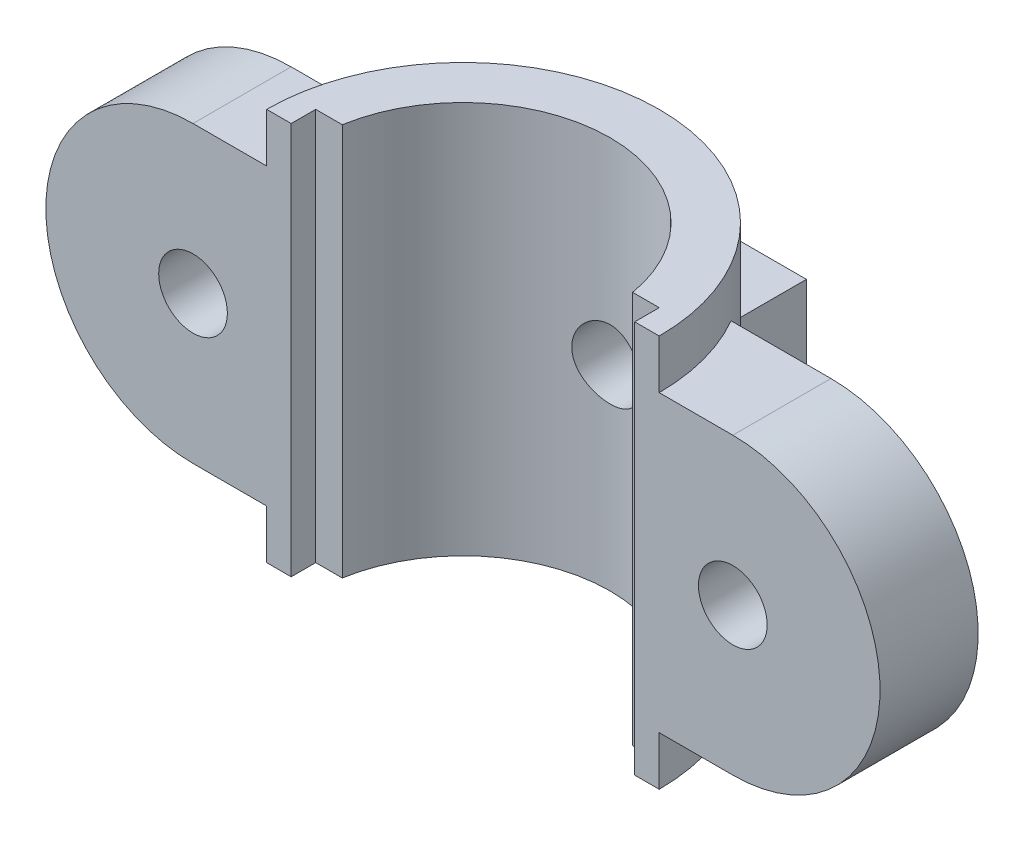
from build123d import *

# Parameters (mm, degrees)
BOSS_EXTRUDE1_DEPTH      = 20
BOSS_EXTRUDE2_DEPTH      = 40
CUT_EXTRUDE1_REACH       = 120.427
SKETCH6_R                = 30
BOSS_EXTRUDE3_REACH      = 108.419
BOSS_EXTRUDE3_END_RADIUS = 40
SKETCH7_W                = 40
SKETCH7_H                = 30
SKETCH7_W_2              = 30
SKETCH7_H_2              = 20
SKETCH8_W                = 70
SKETCH8_H                = 5
CUT_EXTRUDE2_DEPTH       = 121.519707932
HOLE1_D                  = 14
HOLE2_D                  = 14
HOLE2_DEPTH              = 20
HOLE2_CBORE_D            = 20
HOLE2_CBORE_DEPTH        = 5
HOLE2_TIP                = 4.206024333


with BuildPart() as part:
    # Sketch1 → Boss-Extrude1 (new body)
    with BuildSketch(Plane.XY):
        with BuildLine():
            Line((-55, 30), (55, 30))
            ThreePointArc((55, 30), (85, 0), (55, -30))
            Line((55, -30), (-55, -30))
            ThreePointArc((-55, -30), (-85, 0), (-55, 30))
        make_face()
    extrude(amount=BOSS_EXTRUDE1_DEPTH)

    # Sketch5 → Boss-Extrude2 (add, symmetric)
    with BuildSketch(Plane(origin=(0, 0, 0), x_dir=(1, 0, 0), z_dir=(0, 1, 0))):
        with BuildLine():
            Line((-40, -20), (40, -20))
            ThreePointArc((40, -20), (0, 20), (-40, -20))
        make_face()
    extrude(amount=BOSS_EXTRUDE2_DEPTH, both=True)

    # Sketch6 → Cut-Extrude1 (cut, up to next)
    with BuildSketch(Plane(origin=(0, -40, 0), x_dir=(-1, 0, 0), z_dir=(0, -1, 0)), mode=Mode.PRIVATE) as cut_extrude1_sk1:
        with Locations((0, -20)):
            Circle(SKETCH6_R)
    cut_extrude1_tool1 = extrude(cut_extrude1_sk1.sketch, amount=-CUT_EXTRUDE1_REACH, mode=Mode.PRIVATE) & part.part
    add(cut_extrude1_tool1.solids().sort_by_distance((0, -40, 20))[0], mode=Mode.SUBTRACT)

    # Boss-Extrude3: up to this cylinder (the profile starts outside it)
    boss_extrude3_end = Plane(origin=(0, 14.5, 20), z_dir=(0, -1, 0)) * Cylinder(BOSS_EXTRUDE3_END_RADIUS, 297.838, mode=Mode.PRIVATE)
    # Sketch7 → Boss-Extrude3 (add, up to the surface)
    with BuildSketch(Plane(origin=(0, 0, -30), x_dir=(-1, 0, 0), z_dir=(0, 0, -1)), mode=Mode.PRIVATE) as boss_extrude3_sk1:
        Rectangle(SKETCH7_W, SKETCH7_H)
        Rectangle(SKETCH7_W_2, SKETCH7_H_2, mode=Mode.SUBTRACT)
    boss_extrude3_tool1 = extrude(boss_extrude3_sk1.sketch, amount=-BOSS_EXTRUDE3_REACH, mode=Mode.PRIVATE) - boss_extrude3_end
    add(boss_extrude3_tool1.solids().sort_by_distance((0, 14.5, -30))[0])

    # Sketch8 → Cut-Extrude2 (cut, through all)
    with BuildSketch(Plane(origin=(0, -40, 0), x_dir=(-1, 0, 0), z_dir=(0, -1, 0))):
        with Locations((0, -17.5)):
            Rectangle(SKETCH8_W, SKETCH8_H)
    extrude(amount=-CUT_EXTRUDE2_DEPTH, mode=Mode.SUBTRACT)

    # Hole1 (through all)
    with Locations(Plane(origin=(0, 0, -30), x_dir=(-1, 0, 0), z_dir=(0, 0, -1))):
        with Locations((0, 0)):
            Hole(HOLE1_D / 2)

    # Hole2
    with Locations(Plane(origin=(0, 0, 0), x_dir=(-1, 0, 0), z_dir=(0, 0, -1))):
        with Locations((-55, 0), (55, 0)):
            CounterBoreHole(HOLE2_D / 2, HOLE2_CBORE_D / 2, HOLE2_CBORE_DEPTH, depth=HOLE2_DEPTH)
            with Locations((0, 0, -(HOLE2_DEPTH + HOLE2_TIP / 2))):  # 118° drill point
                Cone(0, HOLE2_D / 2, HOLE2_TIP, mode=Mode.SUBTRACT)


solid = part.part
